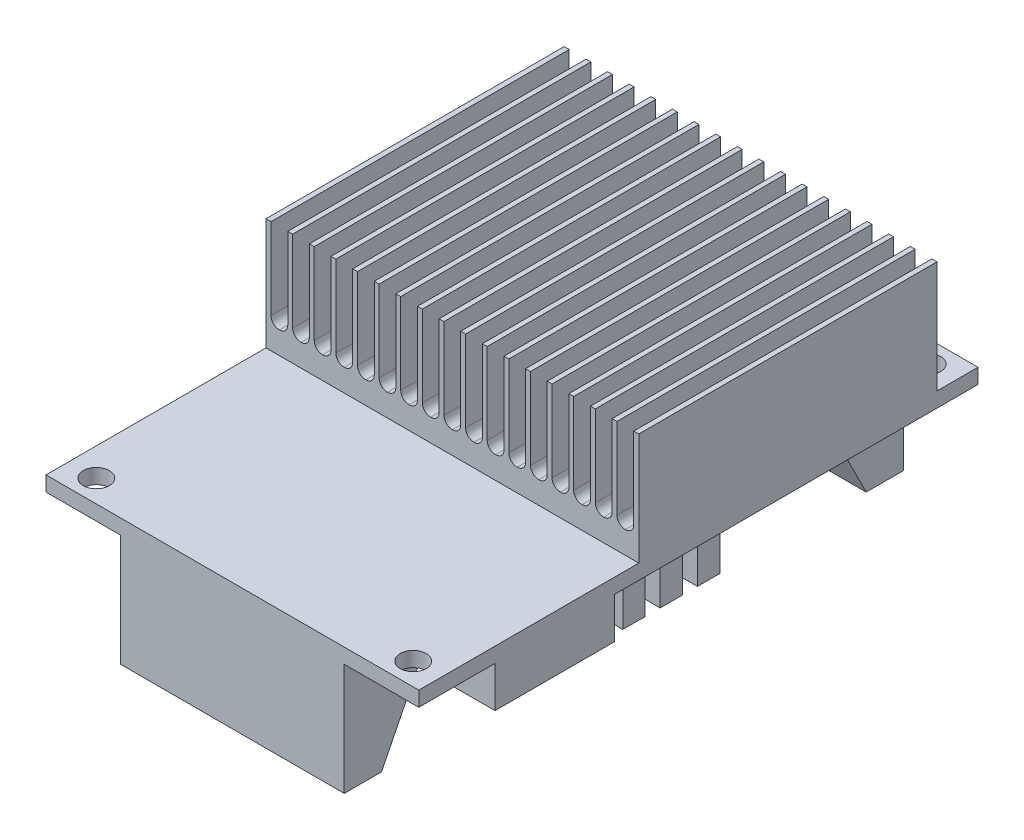
from build123d import *

# Parameters (mm, degrees)
SKETCH1_W            = 50
SKETCH1_H            = 75
BOSS_EXTRUDE1_DEPTH  = 2
SKETCH2_W            = 50
SKETCH2_H            = 40
BOSS_EXTRUDE2_DEPTH  = 15
CUT_EXTRUDE1_DEPTH   = 40
SKETCH4_W            = 30
SKETCH4_H            = 10
BOSS_EXTRUDE3_DEPTH  = 15
CUT_EXTRUDE2_DEPTH   = 30
SKETCH6_R            = 4.75
BOSS_EXTRUDE6_DEPTH  = 17
SKETCH7_W            = 9.72
SKETCH7_H            = 16
BOSS_EXTRUDE9_DEPTH  = 5.5
SKETCH8_W            = 9
SKETCH8_H            = 3
BOSS_EXTRUDE10_DEPTH = 5
SKETCH9_R            = 1.75
CUT_EXTRUDE4_DEPTH   = 2


with BuildPart() as part:
    # Sketch1 → Boss-Extrude1 (new body)
    with BuildSketch(Plane(origin=(0, 0, 0), x_dir=(1, 0, 0), z_dir=(0, 1, 0))):
        Rectangle(SKETCH1_W, SKETCH1_H)
    extrude(amount=BOSS_EXTRUDE1_DEPTH)

    # Sketch2 → Boss-Extrude2 (add)
    with BuildSketch(Plane(origin=(0, 2, 0), x_dir=(1, 0, 0), z_dir=(0, 1, 0))):
        with Locations((0, 12)):
            Rectangle(SKETCH2_W, SKETCH2_H)
    extrude(amount=BOSS_EXTRUDE2_DEPTH)

    # Sketch3 → Cut-Extrude1 (cut)
    with BuildSketch(Plane(origin=(0, 0, -32), x_dir=(-1, 0, 0), z_dir=(0, 0, -1))):
        with BuildLine():
            Line((4.025, 25), (4.025, 6.1))
            ThreePointArc((4.025, 6.1), (3.702817459, 5.322182541), (2.925, 5))
            Line((2.925, 5), (2.875, 5))
            ThreePointArc((2.875, 5), (2.097182541, 5.322182541), (1.775, 6.1))
            Line((1.775, 6.1), (1.775, 25))
            Line((1.775, 25), (4.025, 25))
        make_face()
        with BuildLine():
            Line((-1.125, 25), (1.125, 25))
            Line((1.125, 25), (1.125, 6.1))
            ThreePointArc((1.125, 6.1), (0.802817459, 5.322182541), (0.025, 5))
            Line((0.025, 5), (-0.025, 5))
            ThreePointArc((-0.025, 5), (-0.802817459, 5.322182541), (-1.125, 6.1))
            Line((-1.125, 6.1), (-1.125, 25))
        make_face()
        with BuildLine():
            Line((6.925, 25), (6.925, 6.1))
            ThreePointArc((6.925, 6.1), (6.602817459, 5.322182541), (5.825, 5))
            Line((5.825, 5), (5.775, 5))
            ThreePointArc((5.775, 5), (4.997182541, 5.322182541), (4.675, 6.1))
            Line((4.675, 6.1), (4.675, 25))
            Line((4.675, 25), (6.925, 25))
        make_face()
        with BuildLine():
            Line((9.825, 25), (9.825, 6.1))
            ThreePointArc((9.825, 6.1), (9.502817459, 5.322182541), (8.725, 5))
            Line((8.725, 5), (8.675, 5))
            ThreePointArc((8.675, 5), (7.897182541, 5.322182541), (7.575, 6.1))
            Line((7.575, 6.1), (7.575, 25))
            Line((7.575, 25), (9.825, 25))
        make_face()
        with BuildLine():
            Line((12.725, 25), (12.725, 6.1))
            ThreePointArc((12.725, 6.1), (12.402817459, 5.322182541), (11.625, 5))
            Line((11.625, 5), (11.575, 5))
            ThreePointArc((11.575, 5), (10.797182541, 5.322182541), (10.475, 6.1))
            Line((10.475, 6.1), (10.475, 25))
            Line((10.475, 25), (12.725, 25))
        make_face()
        with BuildLine():
            Line((15.625, 25), (15.625, 6.1))
            ThreePointArc((15.625, 6.1), (15.302817459, 5.322182541), (14.525, 5))
            Line((14.525, 5), (14.475, 5))
            ThreePointArc((14.475, 5), (13.697182541, 5.322182541), (13.375, 6.1))
            Line((13.375, 6.1), (13.375, 25))
            Line((13.375, 25), (15.625, 25))
        make_face()
        with BuildLine():
            Line((18.525, 25), (18.525, 6.1))
            ThreePointArc((18.525, 6.1), (18.202817459, 5.322182541), (17.425, 5))
            Line((17.425, 5), (17.375, 5))
            ThreePointArc((17.375, 5), (16.597182541, 5.322182541), (16.275, 6.1))
            Line((16.275, 6.1), (16.275, 25))
            Line((16.275, 25), (18.525, 25))
        make_face()
        with BuildLine():
            Line((21.425, 25), (21.425, 6.1))
            ThreePointArc((21.425, 6.1), (21.102817459, 5.322182541), (20.325, 5))
            Line((20.325, 5), (20.275, 5))
            ThreePointArc((20.275, 5), (19.497182541, 5.322182541), (19.175, 6.1))
            Line((19.175, 6.1), (19.175, 25))
            Line((19.175, 25), (21.425, 25))
        make_face()
        with BuildLine():
            Line((24.325, 25), (24.325, 6.1))
            ThreePointArc((24.325, 6.1), (24.002817459, 5.322182541), (23.225, 5))
            Line((23.225, 5), (23.175, 5))
            ThreePointArc((23.175, 5), (22.397182541, 5.322182541), (22.075, 6.1))
            Line((22.075, 6.1), (22.075, 25))
            Line((22.075, 25), (24.325, 25))
        make_face()
        with BuildLine():
            Line((-1.775, 25), (-1.775, 6.1))
            ThreePointArc((-1.775, 6.1), (-2.097182541, 5.322182541), (-2.875, 5))
            Line((-2.875, 5), (-2.925, 5))
            ThreePointArc((-2.925, 5), (-3.702817459, 5.322182541), (-4.025, 6.1))
            Line((-4.025, 6.1), (-4.025, 25))
            Line((-4.025, 25), (-1.775, 25))
        make_face()
        with BuildLine():
            Line((-4.675, 25), (-4.675, 6.1))
            ThreePointArc((-4.675, 6.1), (-4.997182541, 5.322182541), (-5.775, 5))
            Line((-5.775, 5), (-5.825, 5))
            ThreePointArc((-5.825, 5), (-6.602817459, 5.322182541), (-6.925, 6.1))
            Line((-6.925, 6.1), (-6.925, 25))
            Line((-6.925, 25), (-4.675, 25))
        make_face()
        with BuildLine():
            Line((-7.575, 25), (-7.575, 6.1))
            ThreePointArc((-7.575, 6.1), (-7.897182541, 5.322182541), (-8.675, 5))
            Line((-8.675, 5), (-8.725, 5))
            ThreePointArc((-8.725, 5), (-9.502817459, 5.322182541), (-9.825, 6.1))
            Line((-9.825, 6.1), (-9.825, 25))
            Line((-9.825, 25), (-7.575, 25))
        make_face()
        with BuildLine():
            Line((-10.475, 25), (-10.475, 6.1))
            ThreePointArc((-10.475, 6.1), (-10.797182541, 5.322182541), (-11.575, 5))
            Line((-11.575, 5), (-11.625, 5))
            ThreePointArc((-11.625, 5), (-12.402817459, 5.322182541), (-12.725, 6.1))
            Line((-12.725, 6.1), (-12.725, 25))
            Line((-12.725, 25), (-10.475, 25))
        make_face()
        with BuildLine():
            Line((-13.375, 25), (-13.375, 6.1))
            ThreePointArc((-13.375, 6.1), (-13.697182541, 5.322182541), (-14.475, 5))
            Line((-14.475, 5), (-14.525, 5))
            ThreePointArc((-14.525, 5), (-15.302817459, 5.322182541), (-15.625, 6.1))
            Line((-15.625, 6.1), (-15.625, 25))
            Line((-15.625, 25), (-13.375, 25))
        make_face()
        with BuildLine():
            Line((-16.275, 25), (-16.275, 6.1))
            ThreePointArc((-16.275, 6.1), (-16.597182541, 5.322182541), (-17.375, 5))
            Line((-17.375, 5), (-17.425, 5))
            ThreePointArc((-17.425, 5), (-18.202817459, 5.322182541), (-18.525, 6.1))
            Line((-18.525, 6.1), (-18.525, 25))
            Line((-18.525, 25), (-16.275, 25))
        make_face()
        with BuildLine():
            Line((-19.175, 25), (-19.175, 6.1))
            ThreePointArc((-19.175, 6.1), (-19.497182541, 5.322182541), (-20.275, 5))
            Line((-20.275, 5), (-20.325, 5))
            ThreePointArc((-20.325, 5), (-21.102817459, 5.322182541), (-21.425, 6.1))
            Line((-21.425, 6.1), (-21.425, 25))
            Line((-21.425, 25), (-19.175, 25))
        make_face()
        with BuildLine():
            Line((-22.075, 25), (-22.075, 6.1))
            ThreePointArc((-22.075, 6.1), (-22.397182541, 5.322182541), (-23.175, 5))
            Line((-23.175, 5), (-23.225, 5))
            ThreePointArc((-23.225, 5), (-24.002817459, 5.322182541), (-24.325, 6.1))
            Line((-24.325, 6.1), (-24.325, 25))
            Line((-24.325, 25), (-22.075, 25))
        make_face()
    extrude(amount=-CUT_EXTRUDE1_DEPTH, mode=Mode.SUBTRACT)

    # Sketch4 → Boss-Extrude3 (add)
    with BuildSketch(Plane.XZ):
        with Locations((0, 32.5)):
            Rectangle(SKETCH4_W, SKETCH4_H)
        with Locations((0, -32.5)):
            Rectangle(SKETCH4_W, SKETCH4_H)
    extrude(amount=BOSS_EXTRUDE3_DEPTH)

    # Sketch5 → Cut-Extrude2 (cut)
    with BuildSketch(Plane.ZY.offset(15)):
        Polygon((-27.5, -15), (-27.5, -5), (-32.5, -15), align=None)
        Polygon((32.5, -15), (27.5, -15), (27.5, -5), align=None)
    extrude(amount=-CUT_EXTRUDE2_DEPTH, mode=Mode.SUBTRACT)

    # Sketch6 → Boss-Extrude6 (add)
    with BuildSketch(Plane.XZ):
        with Locations(Location((-20, -27.5, 0), (0, 0, 90))):
            Circle(SKETCH6_R)
    extrude(amount=BOSS_EXTRUDE6_DEPTH)

    # Sketch7 → Boss-Extrude9 (add)
    with BuildSketch(Plane.XZ):
        with Locations((20.14, 19.274770973)):
            Rectangle(SKETCH7_W, SKETCH7_H)
    extrude(amount=BOSS_EXTRUDE9_DEPTH)

    # Sketch8 → Boss-Extrude10 (add)
    with BuildSketch(Plane(origin=(0, 0, 0), x_dir=(-1, 0, 0), z_dir=(0, -1, 0))):
        with Locations((-20.14, -3.274770973)):
            Rectangle(SKETCH8_W, SKETCH8_H)
        with Locations((-20.14, -8.274770973)):
            Rectangle(SKETCH8_W, SKETCH8_H)
        with Locations((-20.14, 1.725229027)):
            Rectangle(SKETCH8_W, SKETCH8_H)
    extrude(amount=BOSS_EXTRUDE10_DEPTH)

    # Sketch9 → Cut-Extrude4 (cut)
    with BuildSketch(Plane(origin=(0, 2, 0), x_dir=(1, 0, 0), z_dir=(0, 1, 0))):
        with Locations(Location((-21.25, 34.5, 0), (0, 0, 270))):
            Circle(SKETCH9_R)
        with Locations(Location((21.25, 34.5, 0), (0, 0, 270))):
            Circle(SKETCH9_R)
        with Locations(Location((-21.25, -34.5, 0), (0, 0, 270))):
            Circle(SKETCH9_R)
        with Locations(Location((21.25, -34.5, 0), (0, 0, 270))):
            Circle(SKETCH9_R)
    extrude(amount=-CUT_EXTRUDE4_DEPTH, mode=Mode.SUBTRACT)


solid = part.part
